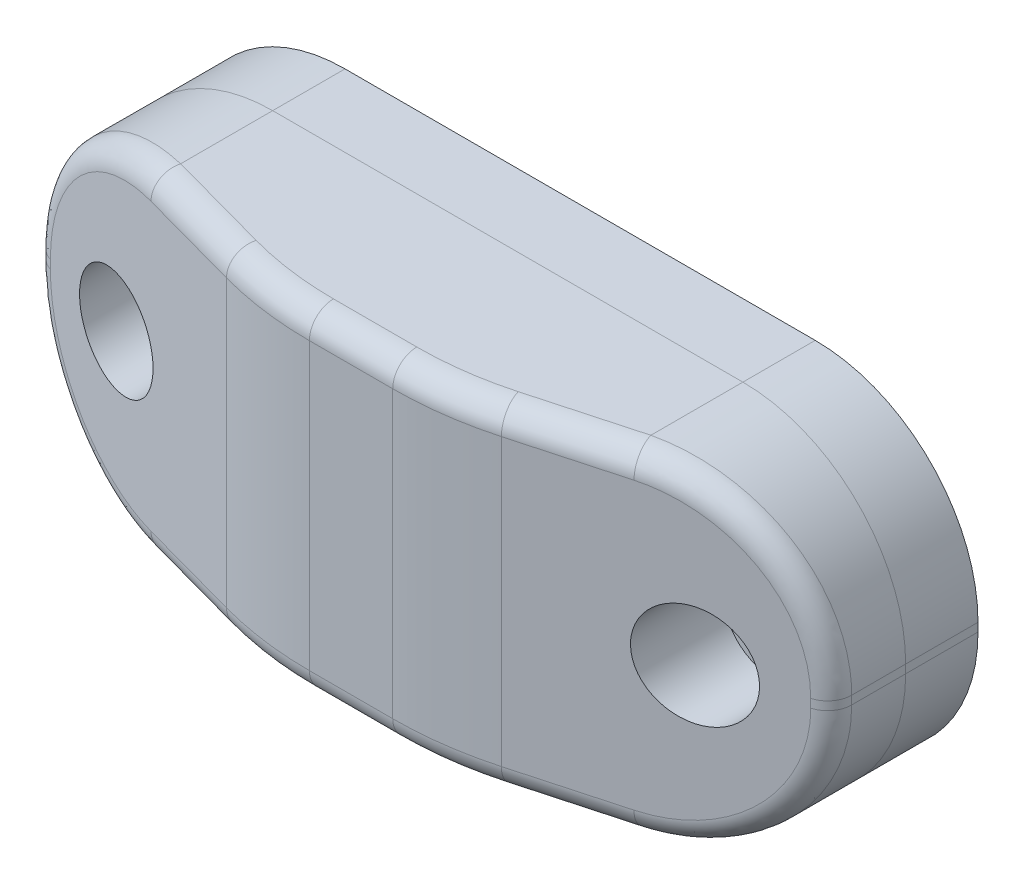
from build123d import *

# Parameters (mm, degrees)
SKETCH1_R           = 2.3
BOSS_EXTRUDE1_DEPTH = 19
CUT_EXTRUDE1_DEPTH  = 48.088108902
FILLET1_R           = 30
FILLET2_R           = 2
SKETCH3_R           = 4.2
CUT_EXTRUDE2_DEPTH  = 11
SKETCH4_W           = 9
SKETCH4_H           = 13
BOSS_EXTRUDE2_DEPTH = 1


with BuildPart() as part:
    # Sketch1 → Boss-Extrude1 (new body)
    with BuildSketch(Plane.XY):
        with BuildLine():
            Line((-19.5, 13.85), (19.5, 13.85))
            ThreePointArc((19.5, 13.85), (29.045941546, 9.895941546), (33, 0.35))
            Line((33, 0.35), (33, -0.35))
            ThreePointArc((33, -0.35), (29.045941546, -9.895941546), (19.5, -13.85))
            Line((19.5, -13.85), (-19.5, -13.85))
            ThreePointArc((-19.5, -13.85), (-29.045941546, -9.895941546), (-33, -0.35))
            Line((-33, -0.35), (-33, 0.35))
            ThreePointArc((-33, 0.35), (-29.045941546, 9.895941546), (-19.5, 13.85))
        make_face()
        with Locations((-24, 0)):
            Circle(SKETCH1_R, mode=Mode.SUBTRACT)
        with Locations((24, 0)):
            Circle(SKETCH1_R, mode=Mode.SUBTRACT)
    extrude(amount=BOSS_EXTRUDE1_DEPTH)

    # Sketch2 → Cut-Extrude1 (cut, through all)
    with BuildSketch(Plane.XZ.offset(13.85)):
        Polygon((-19.5, 19), (-19.5, 15.705882353), (-7.5, 19), align=None)
        Polygon((-33, 12), (-19.5, 15.705882353), (-19.5, 19), (-33, 19), align=None)
        Polygon((7.5, 19), (19.5, 15.705882353), (19.5, 19), align=None)
        Polygon((19.5, 19), (19.5, 15.705882353), (33, 12), (33, 19), align=None)
    extrude(amount=-CUT_EXTRUDE1_DEPTH, mode=Mode.SUBTRACT)

    # Fillet1
    fillet1_edges = [part.edges().sort_by_distance(p)[0] for p in [
        (-7.5, 0, 19),
        (7.5, 0, 19),
    ]]
    fillet(fillet1_edges, radius=FILLET1_R)

    # Fillet2
    fillet2_edges = [part.edges().sort_by_distance(p)[0] for p in [
        (-33, 0, 12),
        (-15.449321203, -13.85, 16.817833395),
        (-28.958901568, 9.982195032, 13.109321138),
        (-15.449321203, 13.85, 16.817833395),
        (-28.958901568, -9.982195032, 13.109321138),
        (33, 0, 12),
        (15.449321203, -13.85, 16.817833395),
        (28.958901568, 9.982195032, 13.109321138),
        (28.958901568, -9.982195032, 13.109321138),
        (15.449321203, 13.85, 16.817833395),
        (0, -13.85, 19),
        (-7.463781607, -13.85, 18.731242264),
        (7.463781607, -13.85, 18.731242264),
        (0, 13.85, 19),
        (-7.463781607, 13.85, 18.731242264),
        (7.463781607, 13.85, 18.731242264),
    ]]
    fillet(fillet2_edges, radius=FILLET2_R)

    # Sketch3 → Cut-Extrude2 (cut)
    with BuildSketch(Plane.XY.offset(19)):
        with Locations((-24, 0)):
            Circle(SKETCH3_R)
        with Locations(Location((24, 0, 0), (0, 0, 180))):
            Circle(SKETCH3_R)
    extrude(amount=-CUT_EXTRUDE2_DEPTH, mode=Mode.SUBTRACT)

    # Sketch4 → Boss-Extrude2 (add)
    with BuildSketch(Plane(origin=(0, 0, 0), x_dir=(-1, 0, 0), z_dir=(0, 0, -1))):
        Rectangle(SKETCH4_W, SKETCH4_H)
    extrude(amount=BOSS_EXTRUDE2_DEPTH)


solid = part.part
